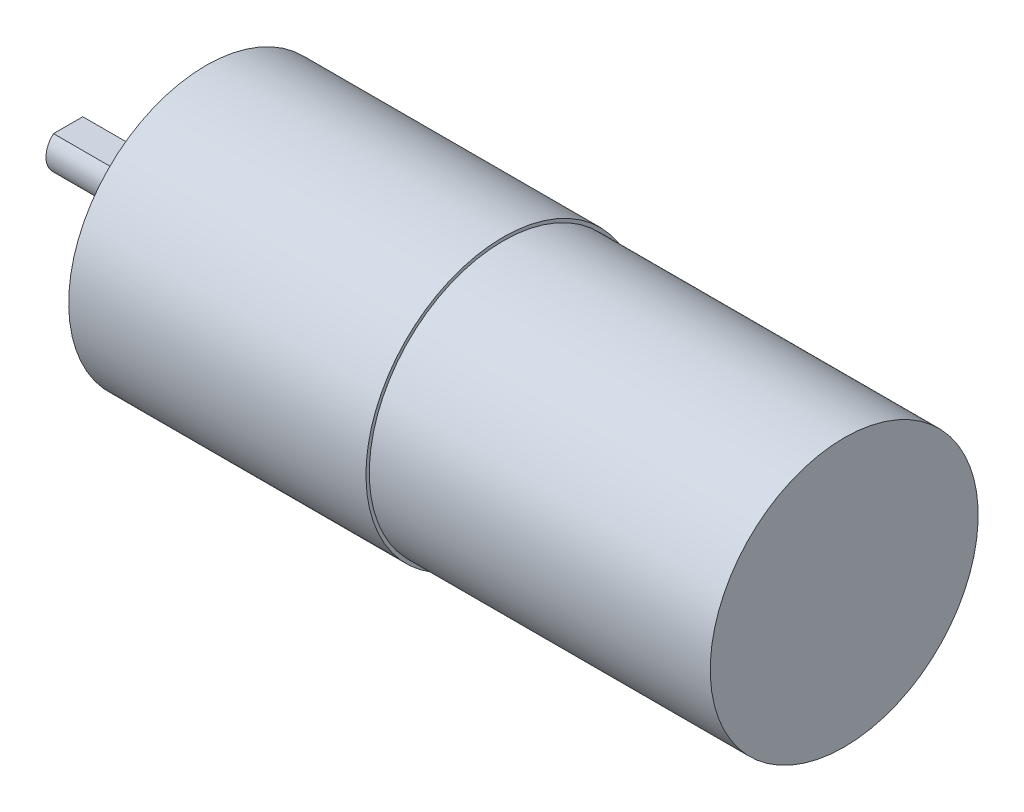
from build123d import *

# Parameters (mm, degrees)
CUT_EXTRUDE1_START = -8
CUT_EXTRUDE1_DEPTH = 8


with BuildPart() as part:
    # Sketch2 → Revolve3 (revolve)
    with BuildSketch(Plane.XY):
        Polygon((-42.25, 12.4), (-15.4, 12.4), (-15.4, 12.1), (15.4, 12.1), (15.4, 0), (-54.7, 0), (-54.7, 2), (-44.8, 2), (-44.8, 3.475), (-42.25, 3.475), align=None)
    revolve(axis=Axis((-28.825, 0, 0), (-1, 0, 0)))

    # Sketch3 → Cut-Extrude1 (cut)
    with BuildSketch(Plane.ZY.offset(54.7).offset(CUT_EXTRUDE1_START)):
        with BuildLine():
            Line((-1.322875656, 1.5), (1.322875656, 1.5))
            ThreePointArc((1.322875656, 1.5), (0, 2), (-1.322875656, 1.5))
        make_face()
    extrude(amount=CUT_EXTRUDE1_DEPTH, mode=Mode.SUBTRACT)


solid = part.part
